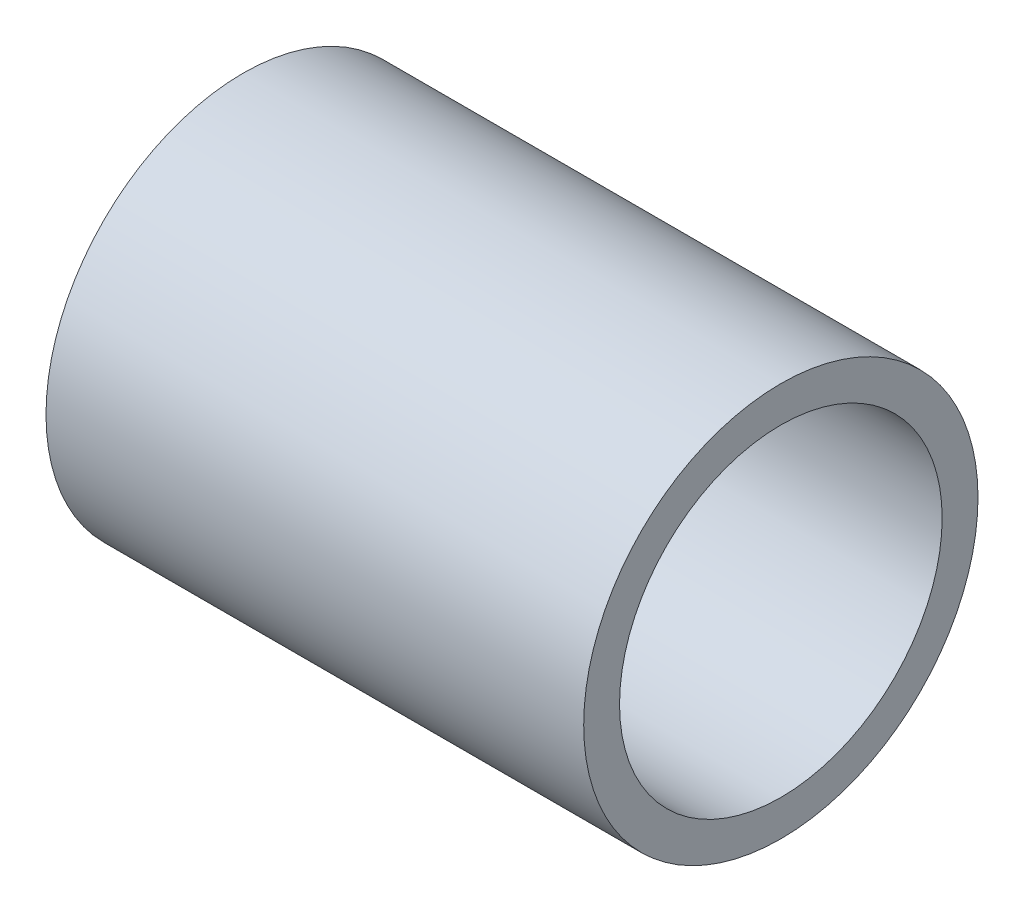
from build123d import *

# Parameters (mm, degrees)
SKETCH1_R      = 11
SKETCH1_R_2    = 9
EXTRUDE1_DEPTH = 30


with BuildPart() as part:
    # Sketch1 → Extrude1 (new body)
    with BuildSketch(Plane(origin=(0, 0, 0), x_dir=(0, 0, -1), z_dir=(1, 0, 0))):
        Circle(SKETCH1_R)
        Circle(SKETCH1_R_2, mode=Mode.SUBTRACT)
    extrude(amount=EXTRUDE1_DEPTH)


solid = part.part
